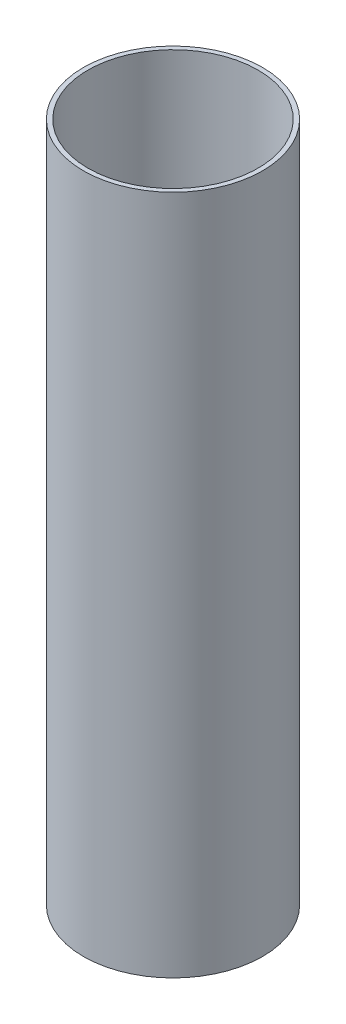
from build123d import *

# Parameters (mm, degrees)
SKETCH1_R           = 32.9
SKETCH1_R_2         = 31.25
BOSS_EXTRUDE1_DEPTH = 125


with BuildPart() as part:
    # Sketch1 → Boss-Extrude1 (new, symmetric)
    with BuildSketch(Plane(origin=(0, 0, 0), x_dir=(1, 0, 0), z_dir=(0, 1, 0))):
        with Locations(Location((0, 0, 0), (0, 0, 270))):
            Circle(SKETCH1_R)
        with Locations(Location((0, 0, 0), (0, 0, 270))):
            Circle(SKETCH1_R_2, mode=Mode.SUBTRACT)
    extrude(amount=BOSS_EXTRUDE1_DEPTH, both=True)


solid = part.part
